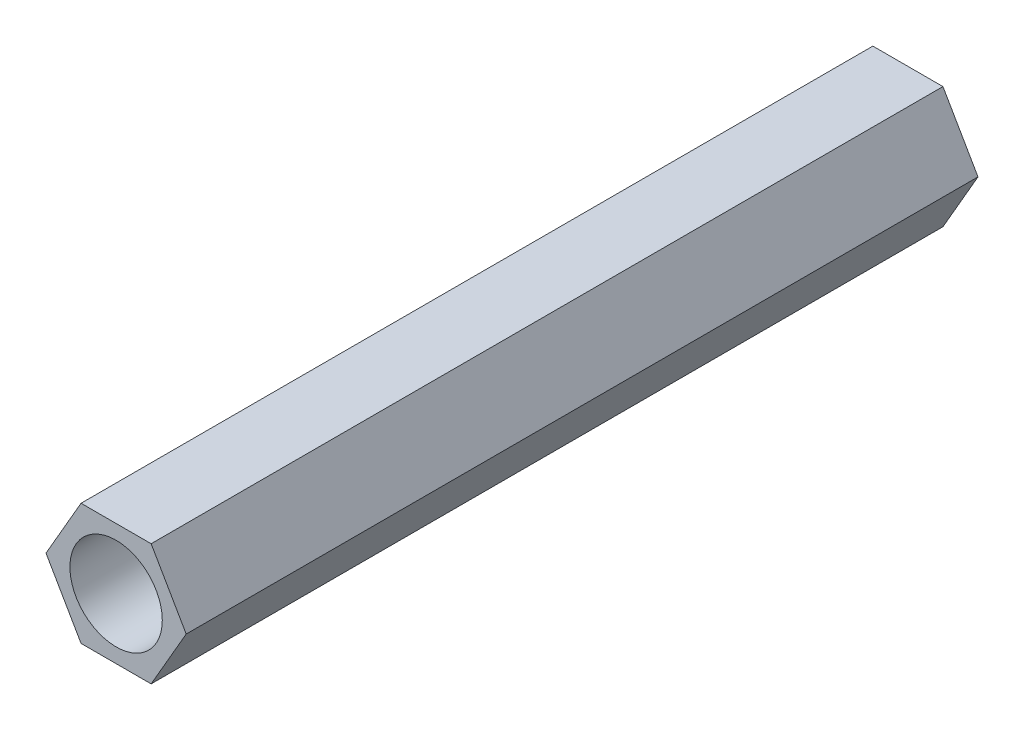
from build123d import *

# Parameters (mm, degrees)
SALIENTE_EXTRUIR1_DEPTH = 30
CROQUIS2_R              = 1.75
CORTAR_EXTRUIR1_DEPTH   = 31.205021658


with BuildPart() as part:
    # Croquis1 → Saliente-Extruir1 (new body)
    with BuildSketch(Plane.XY):
        Polygon((2.655811238, 0), (1.327905619, 2.3), (-1.327905619, 2.3), (-2.655811238, 0), (-1.327905619, -2.3), (1.327905619, -2.3), align=None)
    extrude(amount=SALIENTE_EXTRUIR1_DEPTH)

    # Croquis2 → Cortar-Extruir1 (cut, through all)
    with BuildSketch(Plane.XY.offset(30)):
        Circle(CROQUIS2_R)
    extrude(amount=-CORTAR_EXTRUIR1_DEPTH, mode=Mode.SUBTRACT)


solid = part.part
